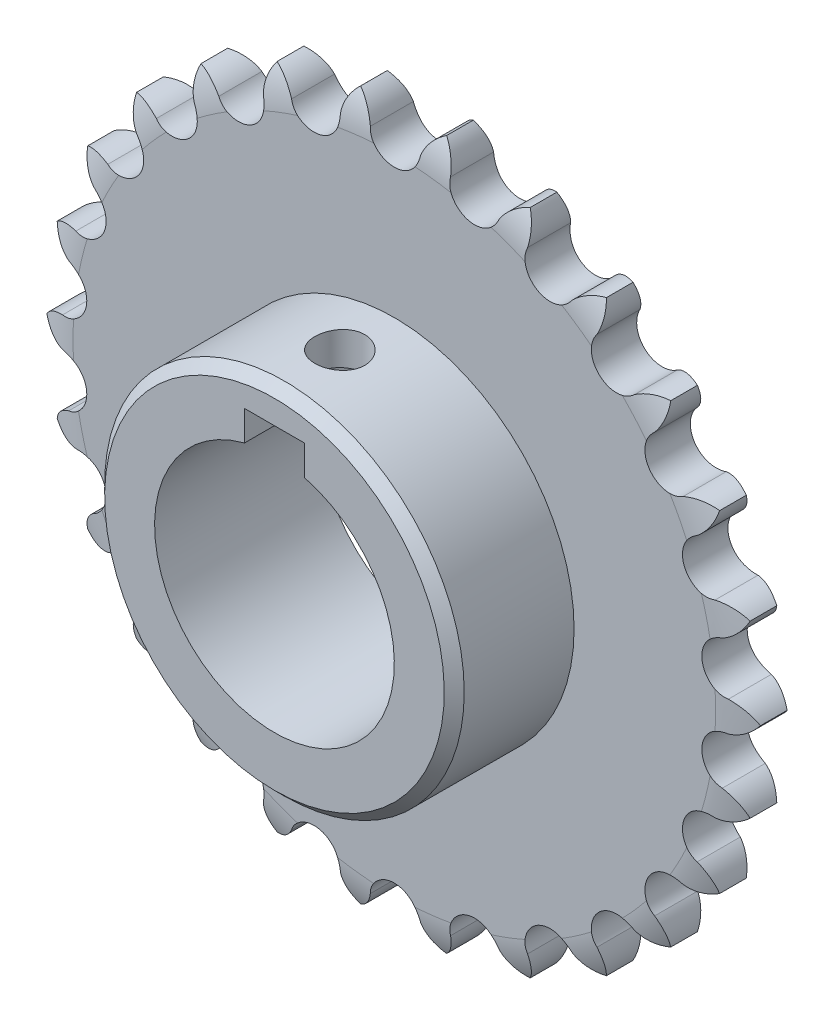
from build123d import *

# Parameters (mm, degrees)
SKETCH1_R                   = 19.05
BOSS_EXTRUDE1_DEPTH         = 7.2136
SKETCH2_W                   = 19.05
SKETCH2_H                   = 9.525
CHAMFER1_SIZE               = 1.5875
SKETCH3_W                   = 9.525
SKETCH3_H                   = 4.7625
CUT_EXTRUDE1_DEPTH          = 26.2636
F_3_8_16_TAPPED_HOLE1_D     = 7.9375
F_3_8_16_TAPPED_HOLE1_DEPTH = 7.112
F_3_8_16_TAPPED_HOLE1_TIP   = 2.384665582


with BuildPart() as part:
    # Sketch1 → Boss-Extrude1 (new body)
    with BuildSketch(Plane.XY):
        with BuildLine():
            ThreePointArc((8.755799366, 52.223570249), (8.204276528, 54.451920369), (6.835417763, 56.294730011))
            ThreePointArc((6.835417763, 56.294730011), (5.065322332, 54.833058413), (3.996546656, 52.801448152))
            ThreePointArc((3.996546656, 52.801448152), (2.84674119, 50.439975583), (0.485268621, 49.290170117))
            ThreePointArc((0.485268621, 49.290170117), (0, 49.260816773), (-0.485268621, 49.290170117))
            ThreePointArc((-0.485268621, 49.290170117), (-2.84674119, 50.439975583), (-3.996546656, 52.801448152))
            ThreePointArc((-3.996546656, 52.801448152), (-5.065322332, 54.833058413), (-6.835417763, 56.294730011))
            ThreePointArc((-6.835417763, 56.294730011), (-8.204276528, 54.451920369), (-8.755799366, 52.223570249))
            ThreePointArc((-8.755799366, 52.223570249), (-9.307056198, 49.655551322), (-11.324742208, 47.974019737))
            ThreePointArc((-11.324742208, 47.974019737), (-11.788885089, 47.829386966), (-12.267077401, 47.741754972))
            ThreePointArc((-12.267077401, 47.741754972), (-14.835096328, 48.293011804), (-16.516627914, 50.310697814))
            ThreePointArc((-16.516627914, 50.310697814), (-18.04054307, 52.027498412), (-20.109003654, 53.023084926))
            ThreePointArc((-20.109003654, 53.023084926), (-20.997072658, 50.906234638), (-20.999290155, 48.610648269))
            ThreePointArc((-20.999290155, 48.610648269), (-20.91996131, 45.98532691), (-22.476600183, 43.869793708))
            ThreePointArc((-22.476600183, 43.869793708), (-22.892643028, 43.61828704), (-23.335968232, 43.418762563))
            ThreePointArc((-23.335968232, 43.418762563), (-25.961289591, 43.339433718), (-28.076822792, 44.89607259))
            ThreePointArc((-28.076822792, 44.89607259), (-29.967313019, 46.198289315), (-32.213927346, 46.669930876))
            ThreePointArc((-32.213927346, 46.669930876), (-32.569595246, 44.402063587), (-32.02237853, 42.172652103))
            ThreePointArc((-32.02237853, 42.172652103), (-31.317074312, 39.642602447), (-32.322199854, 37.21601473))
            ThreePointArc((-32.322199854, 37.21601473), (-32.665963766, 36.872250818), (-33.048657412, 36.572429494))
            ThreePointArc((-33.048657412, 36.572429494), (-35.578707068, 35.867125276), (-38.005294785, 36.872250818))
            ThreePointArc((-38.005294785, 36.872250818), (-40.152491663, 37.684203568), (-42.446694674, 37.604490082))
            ThreePointArc((-42.446694674, 37.604490082), (-42.249291344, 35.317405994), (-41.184442661, 33.283734689))
            ThreePointArc((-41.184442661, 33.283734689), (-39.894152787, 30.995994025), (-40.289350757, 28.39937625))
            ThreePointArc((-40.289350757, 28.39937625), (-40.540857425, 27.983333404), (-40.84067875, 27.600639758))
            ThreePointArc((-40.84067875, 27.600639758), (-43.128419414, 26.310349885), (-45.725037189, 26.705547854))
            ThreePointArc((-45.725037189, 26.705547854), (-48.004153439, 26.980048885), (-50.212614394, 26.353613011))
            ThreePointArc((-50.212614394, 26.353613011), (-49.473612199, 24.180229139), (-47.953016684, 22.460487596))
            ThreePointArc((-47.953016684, 22.460487596), (-46.152728112, 20.548011096), (-45.91503104, 17.932269249))
            ThreePointArc((-45.91503104, 17.932269249), (-46.059663811, 17.468126367), (-46.259188289, 17.024801164))
            ThreePointArc((-46.259188289, 17.024801164), (-48.171664789, 15.224512592), (-50.787406635, 14.986815519))
            ThreePointArc((-50.787406635, 14.986815519), (-53.065988305, 14.70791183), (-55.060359482, 13.571159743))
            ThreePointArc((-55.060359482, 13.571159743), (-53.822706542, 11.637785258), (-51.934735679, 10.331918604))
            ThreePointArc((-51.934735679, 10.331918604), (-49.729074638, 8.905852451), (-48.872296612, 6.423003942))
            ThreePointArc((-48.872296612, 6.423003942), (-48.901649956, 5.937735321), (-48.98928195, 5.459543009))
            ThreePointArc((-48.98928195, 5.459543009), (-50.415348103, 3.253881967), (-52.898196612, 2.397103942))
            ThreePointArc((-52.898196612, 2.397103942), (-55.043820819, 1.5810044), (-56.708196612, 0))
            ThreePointArc((-56.708196612, 0), (-55.043820819, -1.5810044), (-52.898196612, -2.397103942))
            ThreePointArc((-52.898196612, -2.397103942), (-50.415348103, -3.253881967), (-48.98928195, -5.459543009))
            ThreePointArc((-48.98928195, -5.459543009), (-48.901649956, -5.937735321), (-48.872296612, -6.423003942))
            ThreePointArc((-48.872296612, -6.423003942), (-49.729074638, -8.905852451), (-51.934735679, -10.331918604))
            ThreePointArc((-51.934735679, -10.331918604), (-53.822706542, -11.637785258), (-55.060359482, -13.571159743))
            ThreePointArc((-55.060359482, -13.571159743), (-53.065988305, -14.70791183), (-50.787406635, -14.986815519))
            ThreePointArc((-50.787406635, -14.986815519), (-48.171664789, -15.224512592), (-46.259188289, -17.024801164))
            ThreePointArc((-46.259188289, -17.024801164), (-46.059663811, -17.468126367), (-45.91503104, -17.932269249))
            ThreePointArc((-45.91503104, -17.932269249), (-46.152728112, -20.548011096), (-47.953016684, -22.460487596))
            ThreePointArc((-47.953016684, -22.460487596), (-49.473612199, -24.180229139), (-50.212614394, -26.353613011))
            ThreePointArc((-50.212614394, -26.353613011), (-48.004153439, -26.980048885), (-45.725037189, -26.705547854))
            ThreePointArc((-45.725037189, -26.705547854), (-43.128419414, -26.310349885), (-40.84067875, -27.600639758))
            ThreePointArc((-40.84067875, -27.600639758), (-40.540857425, -27.983333404), (-40.289350757, -28.39937625))
            ThreePointArc((-40.289350757, -28.39937625), (-39.894152787, -30.995994025), (-41.184442661, -33.283734689))
            ThreePointArc((-41.184442661, -33.283734689), (-42.249291344, -35.317405994), (-42.446694674, -37.604490082))
            ThreePointArc((-42.446694674, -37.604490082), (-40.152491663, -37.684203568), (-38.005294785, -36.872250818))
            ThreePointArc((-38.005294785, -36.872250818), (-35.578707068, -35.867125276), (-33.048657412, -36.572429494))
            ThreePointArc((-33.048657412, -36.572429494), (-32.665963766, -36.872250818), (-32.322199855, -37.21601473))
            ThreePointArc((-32.322199855, -37.21601473), (-31.317074312, -39.642602447), (-32.02237853, -42.172652103))
            ThreePointArc((-32.02237853, -42.172652103), (-32.569595246, -44.402063587), (-32.213927346, -46.669930876))
            ThreePointArc((-32.213927346, -46.669930876), (-29.967313019, -46.198289315), (-28.076822792, -44.89607259))
            ThreePointArc((-28.076822792, -44.89607259), (-25.961289591, -43.339433718), (-23.335968232, -43.418762563))
            ThreePointArc((-23.335968232, -43.418762563), (-22.892643028, -43.61828704), (-22.476600183, -43.869793708))
            ThreePointArc((-22.476600183, -43.869793708), (-20.91996131, -45.98532691), (-20.999290155, -48.610648269))
            ThreePointArc((-20.999290155, -48.610648269), (-20.997072658, -50.906234638), (-20.109003654, -53.023084926))
            ThreePointArc((-20.109003654, -53.023084926), (-18.04054307, -52.027498412), (-16.516627914, -50.310697814))
            ThreePointArc((-16.516627914, -50.310697814), (-14.835096328, -48.293011804), (-12.267077401, -47.741754972))
            ThreePointArc((-12.267077401, -47.741754972), (-11.788885089, -47.829386966), (-11.324742208, -47.974019737))
            ThreePointArc((-11.324742208, -47.974019737), (-9.307056198, -49.655551322), (-8.755799366, -52.223570249))
            ThreePointArc((-8.755799366, -52.223570249), (-8.204276528, -54.451920369), (-6.835417763, -56.294730011))
            ThreePointArc((-6.835417763, -56.294730011), (-5.065322332, -54.833058413), (-3.996546656, -52.801448152))
            ThreePointArc((-3.996546656, -52.801448152), (-2.84674119, -50.439975583), (-0.485268621, -49.290170117))
            ThreePointArc((-0.485268621, -49.290170117), (0, -49.260816773), (0.485268621, -49.290170117))
            ThreePointArc((0.485268621, -49.290170117), (2.84674119, -50.439975583), (3.996546656, -52.801448152))
            ThreePointArc((3.996546656, -52.801448152), (5.065322332, -54.833058413), (6.835417763, -56.294730011))
            ThreePointArc((6.835417763, -56.294730011), (8.204276528, -54.451920369), (8.755799366, -52.223570249))
            ThreePointArc((8.755799366, -52.223570249), (9.307056198, -49.655551322), (11.324742208, -47.974019737))
            ThreePointArc((11.324742208, -47.974019737), (11.788885089, -47.829386966), (12.267077401, -47.741754972))
            ThreePointArc((12.267077401, -47.741754972), (14.835096328, -48.293011804), (16.516627914, -50.310697814))
            ThreePointArc((16.516627914, -50.310697814), (18.04054307, -52.027498412), (20.109003654, -53.023084926))
            ThreePointArc((20.109003654, -53.023084926), (20.997072658, -50.906234638), (20.999290155, -48.610648269))
            ThreePointArc((20.999290155, -48.610648269), (20.91996131, -45.98532691), (22.476600183, -43.869793708))
            ThreePointArc((22.476600183, -43.869793708), (22.892643028, -43.61828704), (23.335968232, -43.418762563))
            ThreePointArc((23.335968232, -43.418762563), (25.961289591, -43.339433718), (28.076822792, -44.89607259))
            ThreePointArc((28.076822792, -44.89607259), (29.967313019, -46.198289315), (32.213927346, -46.669930876))
            ThreePointArc((32.213927346, -46.669930876), (32.569595246, -44.402063587), (32.02237853, -42.172652103))
            ThreePointArc((32.02237853, -42.172652103), (31.317074312, -39.642602447), (32.322199855, -37.21601473))
            ThreePointArc((32.322199855, -37.21601473), (32.665963766, -36.872250818), (33.048657412, -36.572429494))
            ThreePointArc((33.048657412, -36.572429494), (35.578707068, -35.867125276), (38.005294785, -36.872250818))
            ThreePointArc((38.005294785, -36.872250818), (40.152491663, -37.684203568), (42.446694674, -37.604490082))
            ThreePointArc((42.446694674, -37.604490082), (42.249291344, -35.317405994), (41.184442661, -33.283734689))
            ThreePointArc((41.184442661, -33.283734689), (39.894152787, -30.995994025), (40.289350757, -28.39937625))
            ThreePointArc((40.289350757, -28.39937625), (40.540857425, -27.983333404), (40.84067875, -27.600639758))
            ThreePointArc((40.84067875, -27.600639758), (43.128419414, -26.310349885), (45.725037189, -26.705547854))
            ThreePointArc((45.725037189, -26.705547854), (48.004153439, -26.980048885), (50.212614394, -26.353613011))
            ThreePointArc((50.212614394, -26.353613011), (49.473612199, -24.180229139), (47.953016684, -22.460487596))
            ThreePointArc((47.953016684, -22.460487596), (46.152728112, -20.548011096), (45.91503104, -17.932269249))
            ThreePointArc((45.91503104, -17.932269249), (46.059663811, -17.468126367), (46.259188289, -17.024801164))
            ThreePointArc((46.259188289, -17.024801164), (48.171664789, -15.224512592), (50.787406635, -14.986815519))
            ThreePointArc((50.787406635, -14.986815519), (53.065988305, -14.70791183), (55.060359482, -13.571159743))
            ThreePointArc((55.060359482, -13.571159743), (53.822706542, -11.637785258), (51.934735679, -10.331918604))
            ThreePointArc((51.934735679, -10.331918604), (49.729074638, -8.905852451), (48.872296612, -6.423003942))
            ThreePointArc((48.872296612, -6.423003942), (48.901649956, -5.937735321), (48.98928195, -5.459543009))
            ThreePointArc((48.98928195, -5.459543009), (50.415348103, -3.253881967), (52.898196612, -2.397103942))
            ThreePointArc((52.898196612, -2.397103942), (55.043820819, -1.5810044), (56.708196612, 0))
            ThreePointArc((56.708196612, 0), (55.043820819, 1.5810044), (52.898196612, 2.397103942))
            ThreePointArc((52.898196612, 2.397103942), (50.415348103, 3.253881967), (48.98928195, 5.459543009))
            ThreePointArc((48.98928195, 5.459543009), (48.901649956, 5.937735321), (48.872296612, 6.423003942))
            ThreePointArc((48.872296612, 6.423003942), (49.729074638, 8.905852451), (51.934735679, 10.331918604))
            ThreePointArc((51.934735679, 10.331918604), (53.822706542, 11.637785258), (55.060359482, 13.571159743))
            ThreePointArc((55.060359482, 13.571159743), (53.065988305, 14.70791183), (50.787406635, 14.986815519))
            ThreePointArc((50.787406635, 14.986815519), (48.171664789, 15.224512592), (46.259188289, 17.024801164))
            ThreePointArc((46.259188289, 17.024801164), (46.059663811, 17.468126367), (45.91503104, 17.932269249))
            ThreePointArc((45.91503104, 17.932269249), (46.152728112, 20.548011096), (47.953016684, 22.460487596))
            ThreePointArc((47.953016684, 22.460487596), (49.473612199, 24.180229139), (50.212614394, 26.353613011))
            ThreePointArc((50.212614394, 26.353613011), (48.004153439, 26.980048885), (45.725037189, 26.705547854))
            ThreePointArc((45.725037189, 26.705547854), (43.128419414, 26.310349885), (40.84067875, 27.600639758))
            ThreePointArc((40.84067875, 27.600639758), (40.540857425, 27.983333404), (40.289350757, 28.39937625))
            ThreePointArc((40.289350757, 28.39937625), (39.894152787, 30.995994025), (41.184442661, 33.283734689))
            ThreePointArc((41.184442661, 33.283734689), (42.249291344, 35.317405994), (42.446694674, 37.604490082))
            ThreePointArc((42.446694674, 37.604490082), (40.152491663, 37.684203568), (38.005294785, 36.872250818))
            ThreePointArc((38.005294785, 36.872250818), (35.578707068, 35.867125276), (33.048657412, 36.572429494))
            ThreePointArc((33.048657412, 36.572429494), (32.665963766, 36.872250818), (32.322199855, 37.21601473))
            ThreePointArc((32.322199855, 37.21601473), (31.317074312, 39.642602447), (32.02237853, 42.172652103))
            ThreePointArc((32.02237853, 42.172652103), (32.569595246, 44.402063587), (32.213927346, 46.669930876))
            ThreePointArc((32.213927346, 46.669930876), (29.967313019, 46.198289315), (28.076822792, 44.89607259))
            ThreePointArc((28.076822792, 44.89607259), (25.961289591, 43.339433718), (23.335968232, 43.418762563))
            ThreePointArc((23.335968232, 43.418762563), (22.892643028, 43.61828704), (22.476600183, 43.869793708))
            ThreePointArc((22.476600183, 43.869793708), (20.91996131, 45.98532691), (20.999290155, 48.610648269))
            ThreePointArc((20.999290155, 48.610648269), (20.997072658, 50.906234638), (20.109003654, 53.023084926))
            ThreePointArc((20.109003654, 53.023084926), (18.04054307, 52.027498412), (16.516627914, 50.310697814))
            ThreePointArc((16.516627914, 50.310697814), (14.835096328, 48.293011804), (12.267077401, 47.741754972))
            ThreePointArc((12.267077401, 47.741754972), (11.788885089, 47.829386966), (11.324742208, 47.974019737))
            ThreePointArc((11.324742208, 47.974019737), (9.307056198, 49.655551322), (8.755799366, 52.223570249))
        make_face()
        Circle(SKETCH1_R, mode=Mode.SUBTRACT)
    extrude(amount=BOSS_EXTRUDE1_DEPTH)

    # Sketch2 → Revolve1 (revolve)
    with BuildSketch(Plane(origin=(0, 0, 0), x_dir=(0, 0, -1), z_dir=(1, 0, 0))):
        with Locations((-16.7386, 23.8125)):
            Rectangle(SKETCH2_W, SKETCH2_H)
    revolve(axis=Axis((0, 0, 0), (0, 0, 1)))

    # Chamfer1
    chamfer1_edges = [part.edges().sort_by_distance(p)[0] for p in [
        (0, -28.575, 26.2636),
    ]]
    chamfer(chamfer1_edges, length=CHAMFER1_SIZE)

    # Sketch3 → Cut-Extrude1 (cut)
    with BuildSketch(Plane.XY.offset(26.2636)):
        with Locations((0, 20.826333186)):
            Rectangle(SKETCH3_W, SKETCH3_H)
    extrude(amount=-CUT_EXTRUDE1_DEPTH, mode=Mode.SUBTRACT)

    # 3/8-16 Tapped Hole1
    with Locations(Plane(origin=(0, 23.207583186, 0), x_dir=(-1, 0, 0), z_dir=(0, -1, 0))):
        with Locations((0, -15.875)):
            Hole(F_3_8_16_TAPPED_HOLE1_D / 2, depth=F_3_8_16_TAPPED_HOLE1_DEPTH)
            with Locations((0, 0, -(F_3_8_16_TAPPED_HOLE1_DEPTH + F_3_8_16_TAPPED_HOLE1_TIP / 2))):  # 118° drill point
                Cone(0, F_3_8_16_TAPPED_HOLE1_D / 2, F_3_8_16_TAPPED_HOLE1_TIP, mode=Mode.SUBTRACT)

    # Sketch9 → Cut-Revolve1 (revolve, cut)
    with BuildSketch(Plane(origin=(0, 0, 0), x_dir=(0, 0, -1), z_dir=(1, 0, 0)), mode=Mode.PRIVATE) as cut_revolve1_sk:
        with BuildLine():
            Line((-5.6261, 56.896), (-7.593069557, 56.896))
            Line((-7.593069557, 56.896), (-7.593069557, 50.419))
            Line((-7.593069557, 50.419), (-7.2136, 50.419))
            ThreePointArc((-7.2136, 50.419), (-6.852570348, 53.763558909), (-5.6261, 56.896))
        make_face()
        with BuildLine():
            Line((0.379469557, 50.419), (0, 50.419))
            ThreePointArc((0, 50.419), (-0.361029652, 53.763558909), (-1.5875, 56.896))
            Line((-1.5875, 56.896), (0.379469557, 56.896))
            Line((0.379469557, 56.896), (0.379469557, 50.419))
        make_face()
    revolve(cut_revolve1_sk.sketch.rotate(Axis((0, 0, 0), (0, 0, 1)), 270), axis=Axis((0, 0, 0), (0, 0, 1)), mode=Mode.SUBTRACT)


solid = part.part
